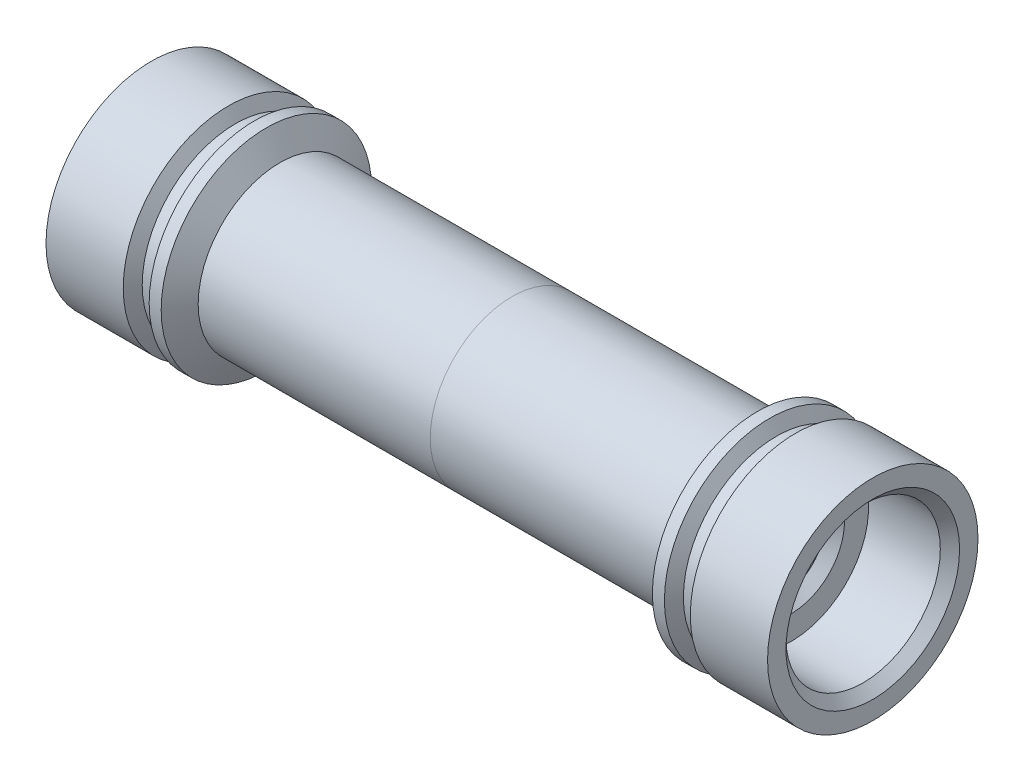
from build123d import *

# Parameters (mm, degrees)
CHAMFER1_SIZE = 0.508


with BuildPart() as part:
    # Sketch2 → Revolve1 (revolve)
    with BuildSketch(Plane.XY, mode=Mode.PRIVATE) as revolve1_sk:
        Polygon((-14.971617421, 5.55625), (-19.05, 5.55625), (-19.05, 4.075), (-14.749999964, 4.075), (-14.749999964, 2.805), (-14.241999964, 2.297), (-14.241999964, 1.905), (-9.098, 1.905), (-9.098, 0), (-8.125000052, 0), (-6.5, 1.625000052), (0, 1.625000052), (0, 4.318), (-12.253478608, 4.318), (-12.968382579, 5.55625), (-13.603382579, 5.55625), (-13.97, 4.92125), (-14.605, 4.92125), align=None)
    revolve(revolve1_sk.sketch.rotate(Axis((-19.05, 0, 0), (1, 0, 0)), 90), axis=Axis((-19.05, 0, 0), (1, 0, 0)))

    # Chamfer1
    chamfer1_edges = [part.edges().sort_by_distance(p)[0] for p in [
        (-19.05, 0, -4.075),
    ]]
    chamfer(chamfer1_edges, length=CHAMFER1_SIZE)


with BuildPart() as body_2:
    # Mirror1: mirrored copy
    add(part.part.mirror(Plane(origin=(0, 0, 0), x_dir=(0, 0, 1), z_dir=(1, 0, 0))))


solid = Compound([part.part, body_2.part])
